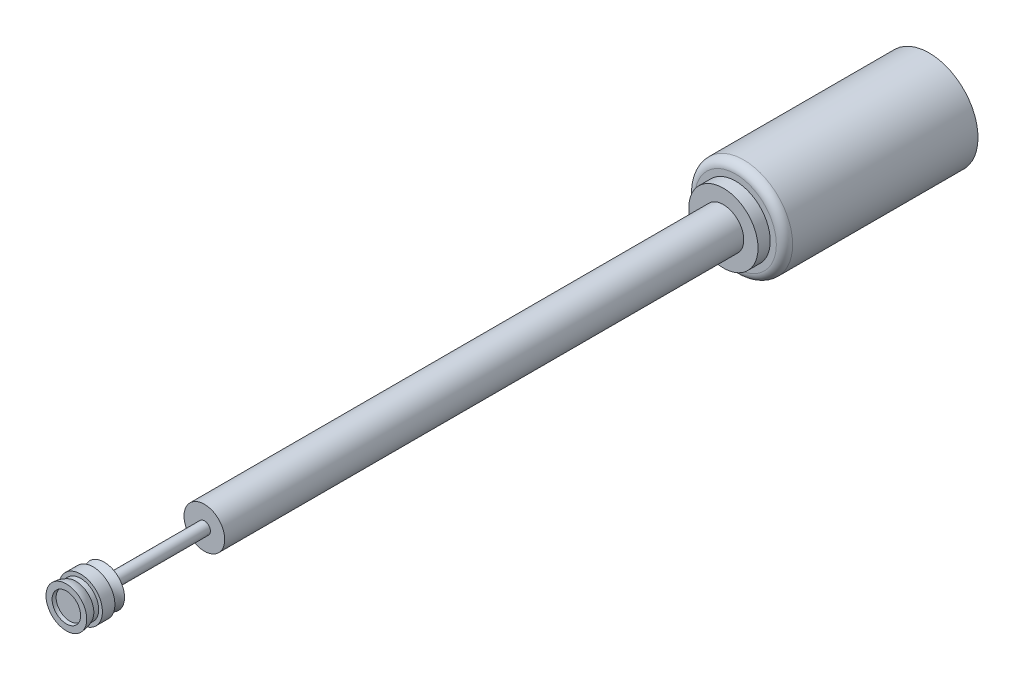
from build123d import *

# Parameters (mm, degrees)
SKETCH1_R           = 0.5
BOSS_EXTRUDE2_DEPTH = 15.5
SKETCH1_3_R         = 1.2
BOSS_EXTRUDE3_DEPTH = 4.75
FILLET1_R           = 0.2
SKETCH2_R           = 0.85
BOSS_EXTRUDE4_DEPTH = 0.3
SKETCH4_W           = 0.452177067
SKETCH4_H           = 0.051188015
SKETCH5_W           = 2.336260119
SKETCH5_H           = 2.46


with BuildPart() as part:
    # Sketch1 → Boss-Extrude2 (new body)
    with BuildSketch(Plane.XY):
        Circle(SKETCH1_R)
    extrude(amount=BOSS_EXTRUDE2_DEPTH)



with BuildPart() as body_2:
    # Sketch1<3> → Boss-Extrude3 (new body)
    with BuildSketch(Plane.XY):
        Circle(SKETCH1_3_R)
    extrude(amount=-BOSS_EXTRUDE3_DEPTH)

    # Fillet1
    fillet1_edges = [body_2.edges().sort_by_distance(p)[0] for p in [
        (-1.2, 0, 0),
    ]]
    fillet(fillet1_edges, radius=FILLET1_R)


with BuildPart() as part_1:
    add(part.part)

    add(body_2.part)  # Boss-Extrude4 merges body 2
    # Sketch2 → Boss-Extrude4 (add)
    with BuildSketch(Plane.XY):
        Circle(SKETCH2_R)
    extrude(amount=BOSS_EXTRUDE4_DEPTH)

    # Sketch3 → Revolve1 (revolve)
    with BuildSketch(Plane(origin=(0, 0, 0), x_dir=(1, 0, 0), z_dir=(0, 1, 0))):
        with BuildLine():
            Line((0.5, -15.5), (0, -15.5))
            Line((0, -15.5), (0, -16.0775))
            ThreePointArc((0, -16.0775), (0.247487373, -16.180012627), (0.35, -16.4275))
            Line((0.35, -16.4275), (0.5, -16.4275))
            ThreePointArc((0.5, -16.4275), (0.485692665, -16.308745486), (0.443589461, -16.196787213))
            Line((0.443589461, -16.196787213), (0.443589461, -16.0775))
            Line((0.443589461, -16.0775), (0.535097449, -16.0775))
            Line((0.535097449, -16.0775), (0.535097449, -15.770986484))
            Line((0.535097449, -15.770986484), (0.388145342, -15.770986484))
            ThreePointArc((0.388145342, -15.770986484), (0.417208297, -15.624404477), (0.5, -15.5))
        make_face()
    revolve(axis=Axis((0, 0, 15.5), (0, 0, 1)))

    # Sketch4 → Revolve2 (revolve)
    with BuildSketch(Plane(origin=(0, 0, 0), x_dir=(1, 0, 0), z_dir=(0, 1, 0))):
        with Locations((-0.226088534, -16.314405992)):
            Rectangle(SKETCH4_W, SKETCH4_H)
    revolve(axis=Axis((0, 0, 16.34), (0, 0, -1)))

    # Sketch5 → Cut-Revolve1 (revolve, cut)
    with BuildSketch(Plane(origin=(0, 0, 0), x_dir=(1, 0, 0), z_dir=(0, 1, 0))):
        with Locations((-1.31613006, -14.27)):
            Rectangle(SKETCH5_W, SKETCH5_H)
    revolve(axis=Axis((0, 0, 16.4275), (0, 0, -1)), mode=Mode.SUBTRACT)


solid = part_1.part
